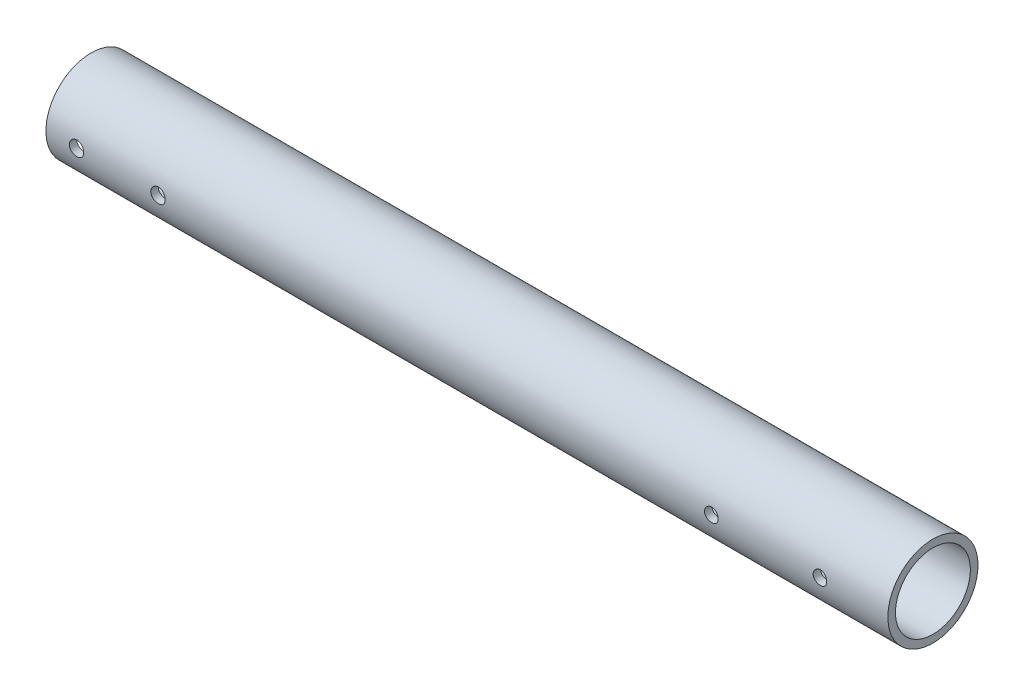
from build123d import *

# Parameters (mm, degrees)
BOSS_EXTRUDE1_DEPTH      = 196.85
BOSS_EXTRUDE1_DEPTH_BACK = 196.85
SKETCH1_R                = 21.082
SKETCH1_R_2              = 17.526
CUT_EXTRUDE1_DEPTH       = 200.095012363
CUT_EXTRUDE1_DEPTH_BACK  = 200.095012363
SKETCH2_R                = 3.3782
SKETCH3_R                = 3.175
CUT_EXTRUDE2_DEPTH       = 200.095012483


with BuildPart() as part:
    # Sketch1 → Boss-Extrude1 (new, two sides: drawn at the far end of the back side and taken through both)
    with BuildSketch(Plane(origin=(0, 0, 0), x_dir=(0, 0, -1), z_dir=(1, 0, 0)).offset(-BOSS_EXTRUDE1_DEPTH_BACK)):
        Circle(SKETCH1_R)
        Circle(SKETCH1_R_2, mode=Mode.SUBTRACT)
    extrude(amount=BOSS_EXTRUDE1_DEPTH + BOSS_EXTRUDE1_DEPTH_BACK)

    # Sketch2 → Cut-Extrude1 (cut, two sides: drawn at the far end of the back side and taken through both)
    with BuildSketch(Plane.XY.offset(-CUT_EXTRUDE1_DEPTH_BACK)):
        with Locations((-144.4625, 0)):
            Circle(SKETCH2_R)
        with Locations((-182.5625, 0)):
            Circle(SKETCH2_R)
    extrude(amount=CUT_EXTRUDE1_DEPTH + CUT_EXTRUDE1_DEPTH_BACK, mode=Mode.SUBTRACT)

    # Sketch3 → Cut-Extrude2 (cut, through all)
    with BuildSketch(Plane.XY):
        with Locations(Location((165.1, 0, 0), (0, 0, 180))):
            Circle(SKETCH3_R)
        with Locations(Location((114.3, 0, 0), (0, 0, 180))):
            Circle(SKETCH3_R)
    extrude(amount=CUT_EXTRUDE2_DEPTH, mode=Mode.SUBTRACT)


solid = part.part
